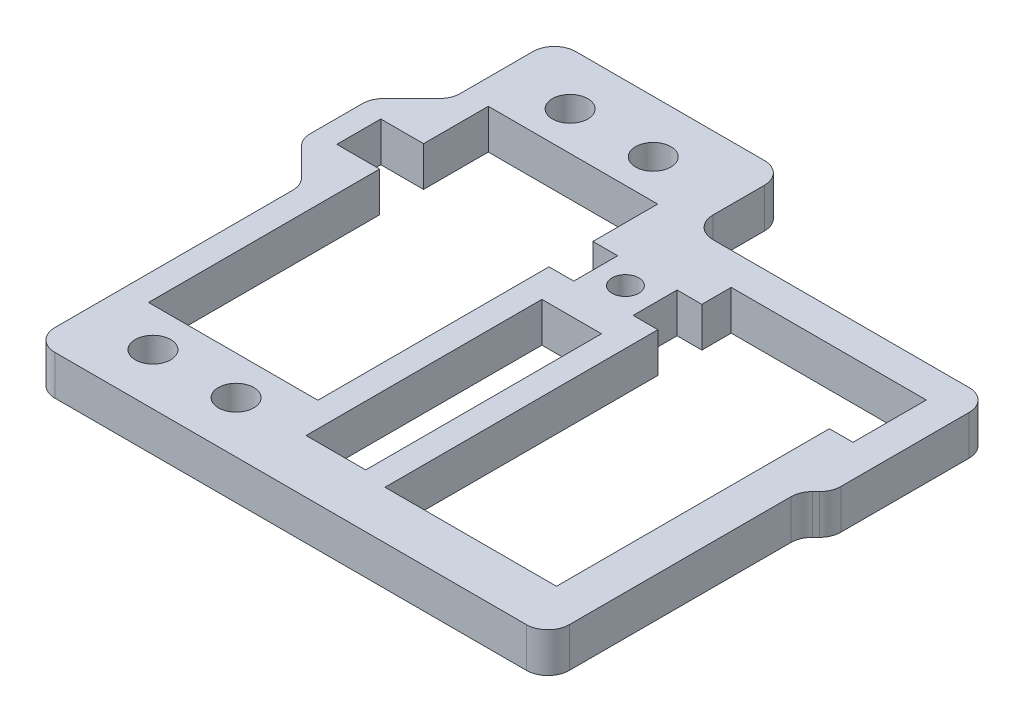
from build123d import *

# Parameters (mm, degrees)
SKETCH1_R           = 1.5875
SKETCH1_R_2         = 2.0955
SKETCH1_W           = 7.0612
SKETCH1_H           = 27.94
BOSS_EXTRUDE1_DEPTH = 4.699
FILLET1_R           = 2.54


with BuildPart() as part:
    # Sketch1 → Boss-Extrude1 (new body)
    with BuildSketch(Plane(origin=(0, 0, 0), x_dir=(1, 0, 0), z_dir=(0, 1, 0))):
        Polygon((0, 0), (30.48, 0), (30.48, 29.845), (32.385, 31.75), (32.385, 50.546), (-3.048, 50.546), (-3.048, 61.722), (-30.48, 61.722), (-30.48, 49.5427), (-35.2425, 44.7802), (-35.2425, 36.5252), (-30.48, 31.7627), (-30.48, 0), align=None)
        with Locations(Location((-0.9906, 40.6527, 0), (0, 0, 270))):
            Circle(SKETCH1_R, mode=Mode.SUBTRACT)
        with Locations(Location((-12.55014, 55.50916, 0), (0, 0, 270))):
            Circle(SKETCH1_R_2, mode=Mode.SUBTRACT)
        with Locations(Location((-22.40026, 55.50916, 0), (0, 0, 270))):
            Circle(SKETCH1_R_2, mode=Mode.SUBTRACT)
        with Locations(Location((-12.55014, 6.08584, 0), (0, 0, 270))):
            Circle(SKETCH1_R_2, mode=Mode.SUBTRACT)
        with Locations(Location((-22.40026, 6.08584, 0), (0, 0, 270))):
            Circle(SKETCH1_R_2, mode=Mode.SUBTRACT)
        Polygon((5.461, 5.715), (25.781, 5.715), (25.781, 38.0492), (28.575, 38.0492), (28.575, 46.736), (5.461, 46.736), (5.461, 43.2562), (2.5273, 43.2562), (2.5273, 38.0492), (5.461, 38.0492), align=None, mode=Mode.SUBTRACT)
        Polygon((-27.5082, 10.668), (-7.4422, 10.668), (-7.4422, 38.0492), (-4.5085, 38.0492), (-4.5085, 43.2562), (-7.4422, 43.2562), (-7.4422, 50.927), (-27.5082, 50.927), (-27.5082, 43.2562), (-32.5755, 43.2562), (-32.5755, 38.0492), (-27.5082, 38.0492), align=None, mode=Mode.SUBTRACT)
        with Locations((-0.9906, 20.32)):
            Rectangle(SKETCH1_W, SKETCH1_H, mode=Mode.SUBTRACT)
    extrude(amount=BOSS_EXTRUDE1_DEPTH)

    # Fillet1
    fillet1_edges = [part.edges().sort_by_distance(p)[0] for p in [
        (-3.048, 2.3495, -50.546),
        (32.385, 2.3495, -50.546),
        (32.385, 2.3495, -31.75),
        (30.48, 2.3495, -29.845),
        (30.48, 2.3495, 0),
        (-30.48, 2.3495, 0),
        (-30.48, 2.3495, -31.7627),
        (-35.2425, 2.3495, -36.5252),
        (-35.2425, 2.3495, -44.7802),
        (-30.48, 2.3495, -49.5427),
        (-30.48, 2.3495, -61.722),
        (-3.048, 2.3495, -61.722),
    ]]
    fillet(fillet1_edges, radius=FILLET1_R)


solid = part.part
